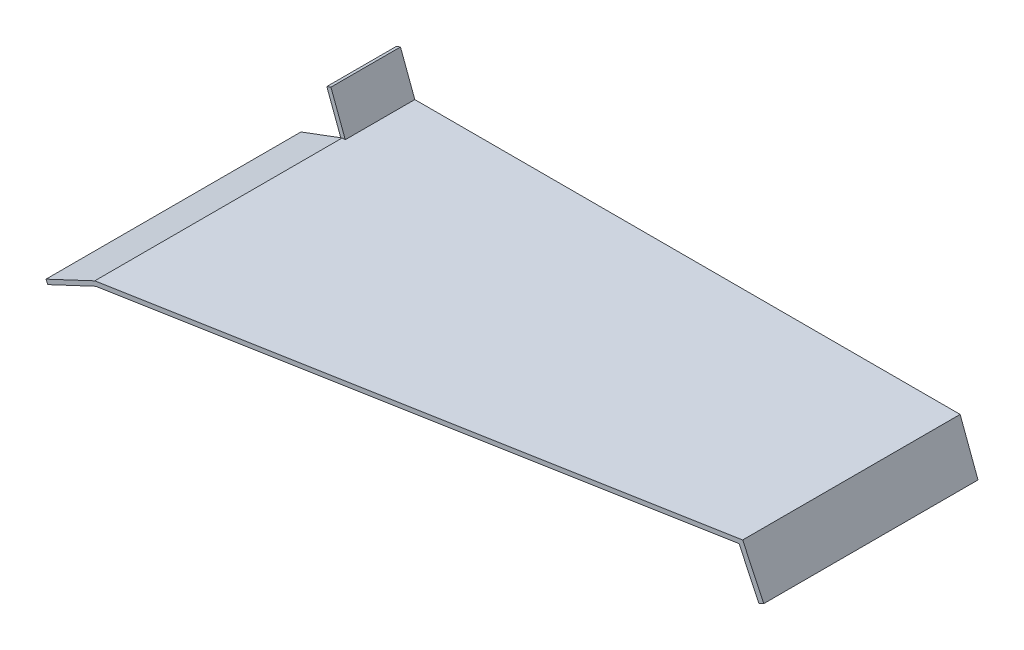
from build123d import *

# Parameters (mm, degrees)
SKETCH1_W           = 395.409928
SKETCH1_H           = 228.6
BOSS_EXTRUDE1_DEPTH = 3.175
CUT_EXTRUDE1_DEPTH  = 3.175
BOSS_EXTRUDE2_REACH = 458.746
BOSS_EXTRUDE3_DEPTH = 50.165
BOSS_EXTRUDE5_REACH = 448.763


with BuildPart() as part:
    # Sketch1 → Boss-Extrude1 (new body)
    with BuildSketch(Plane(origin=(0, 0, 0), x_dir=(1, 0, 0), z_dir=(0, 1, 0))):
        with Locations((197.704964, 114.3)):
            Rectangle(SKETCH1_W, SKETCH1_H)
    extrude(amount=BOSS_EXTRUDE1_DEPTH)

    # Sketch2 → Cut-Extrude1 (cut)
    with BuildSketch(Plane(origin=(0, 3.175, 0), x_dir=(1, 0, 0), z_dir=(0, 1, 0))):
        Polygon((0, 0), (395.409928, 71.795894), (395.409928, 0), align=None)
    extrude(amount=-CUT_EXTRUDE1_DEPTH, mode=Mode.SUBTRACT)

    # Boss-Extrude2: up to this plane
    boss_extrude2_end = Plane(origin=(0, 0, 0), z_dir=(-0.17865222161961358, 0, -0.9839122845611679))
    # Sketch3 → Boss-Extrude2 (add, up to the surface)
    with BuildSketch(Plane(origin=(0, 0, -228.6), x_dir=(-1, 0, 0), z_dir=(0, 0, -1)), mode=Mode.PRIVATE) as boss_extrude2_sk1:
        Polygon((-395.409928, 3.175), (-408.296023119, -31.327136928), (-405.32170097, -32.438007197), (-392.020710392, 3.175), align=None)
    boss_extrude2_tool1 = split(extrude(boss_extrude2_sk1.sketch, amount=-BOSS_EXTRUDE2_REACH, mode=Mode.PRIVATE), bisect_by=boss_extrude2_end, keep=Keep.BOTH, mode=Mode.PRIVATE)
    add(boss_extrude2_tool1.solids().sort_by_distance((400.253689, -14.355253, -228.6))[0])

    # Sketch4 → Boss-Extrude3 (add)
    with BuildSketch(Plane(origin=(0, 0, -228.6), x_dir=(-1, 0, 0), z_dir=(0, 0, -1))):
        Polygon((0, 0), (11.108702689, 29.743221489), (8.13438054, 30.854091758), (-3.389217608, 0), align=None)
    extrude(amount=-BOSS_EXTRUDE3_DEPTH)

    # Boss-Extrude5: up to this plane
    boss_extrude5_end = Plane(origin=(0, 0, 0), z_dir=(-0.17865222161961358, 0, -0.9839122845611679))
    # Sketch6 → Boss-Extrude5 (add, up to the surface)
    with BuildSketch(Plane.XY.offset(-178.435), mode=Mode.PRIVATE) as boss_extrude5_sk1:
        Polygon((0, 3.175), (-29.743221489, -7.933702689), (-28.63235122, -10.908024838), (9.074529477, 3.175), align=None)
    boss_extrude5_tool1 = split(extrude(boss_extrude5_sk1.sketch, amount=BOSS_EXTRUDE5_REACH, mode=Mode.PRIVATE), bisect_by=boss_extrude5_end, keep=Keep.BOTH, mode=Mode.PRIVATE)
    add(boss_extrude5_tool1.solids().sort_by_distance((-12.225047, -3.152196, -178.435))[0])


solid = part.part
